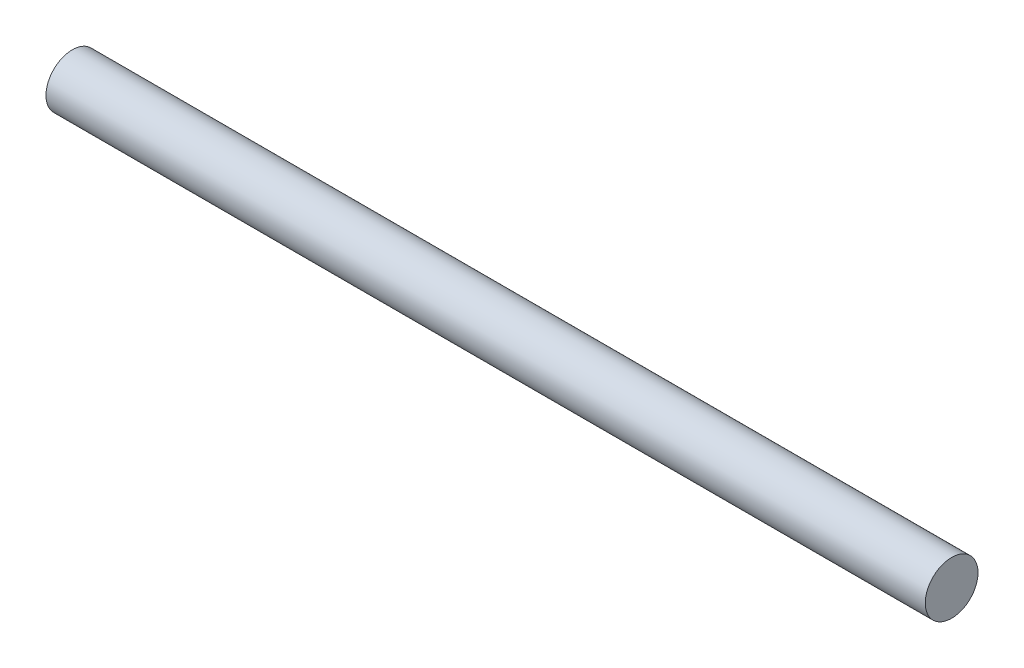
from build123d import *

# Parameters (mm, degrees)
SKETCH1_R           = 6
BOSS_EXTRUDE1_DEPTH = 200


with BuildPart() as part:
    # Sketch1 → Boss-Extrude1 (new body)
    with BuildSketch(Plane(origin=(0, 0, 0), x_dir=(0, 0, -1), z_dir=(1, 0, 0))):
        Circle(SKETCH1_R)
    extrude(amount=BOSS_EXTRUDE1_DEPTH)


solid = part.part
